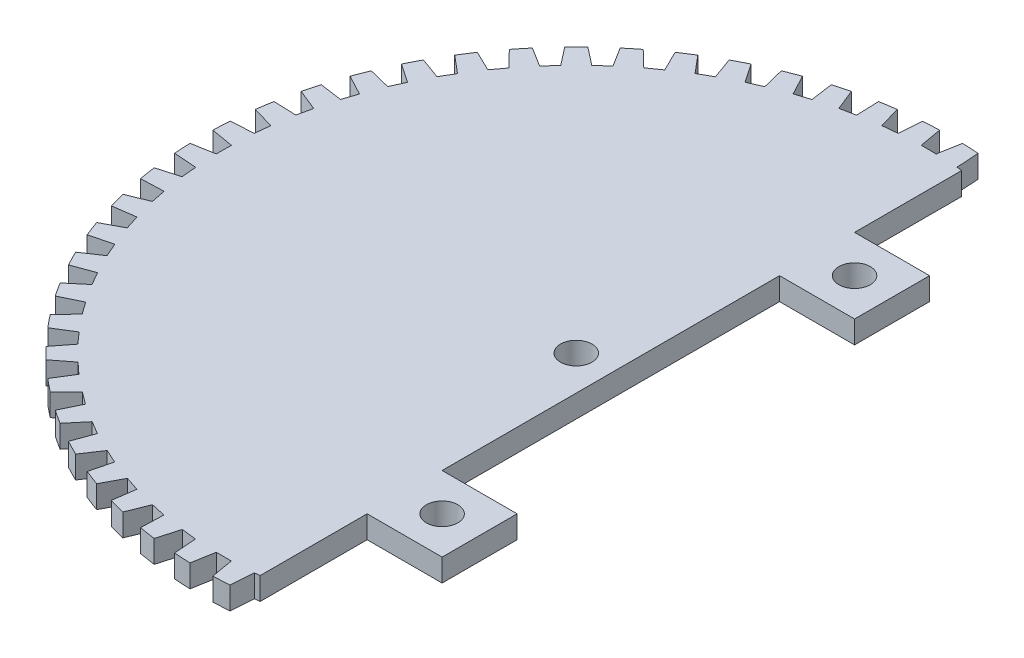
from build123d import *

# Parameters (mm, degrees)
SKETCH_1_R               = 50
EXTRUDE_1_DEPTH          = 3
CUT_EXTRUDE_START        = -3
CUT_EXTRUDE_1_DEPTH      = 3
PATTERN_CIRCULAR_1_COUNT = 60
SKETCH_3_R               = 2.1
CUT_EXTRUDE_2_DEPTH      = 3
SKETCH_7_W               = 107.754666761
SKETCH_7_H               = 25.516796979
CUT_EXTRUDE_3_DEPTH      = 63
SKETCH_8_W               = 20
SKETCH_8_H               = 10
EXTRUDE_2_DEPTH          = 3
SKETCH_9_R               = 2.1
CUT_EXTRUDE_4_DEPTH      = 19


with BuildPart() as part:
    # Эскиз1 → Бобышка-Вытянуть1 (new body)
    with BuildSketch(Plane(origin=(0, 0, 0), x_dir=(1, 0, 0), z_dir=(0, 1, 0))):
        with Locations(Location((0, 0, 0), (0, 0, 270))):
            Circle(SKETCH_1_R)
    extrude(amount=EXTRUDE_1_DEPTH)

    # Эскиз2 → Вырез-Вытянуть1 (cut)
    with BuildSketch(Plane(origin=(0, 3, 0), x_dir=(1, 0, 0), z_dir=(0, 1, 0)).offset(CUT_EXTRUDE_START)):
        with BuildLine():
            Line((-1, 47.010639502), (1, 46.989360498))
            Line((1, 46.989360498), (1.526745916, 49.976685033))
            ThreePointArc((1.526745916, 49.976685033), (0.001866861, 49.999999965), (-1.523013931, 49.976798903))
            Line((-1.523013931, 49.976798903), (-1, 47.010639502))
        make_face()
    cut_extrude_1 = extrude(amount=CUT_EXTRUDE_1_DEPTH, mode=Mode.SUBTRACT)

    # Круговой массив1: Вырез-Вытянуть1 ×60 about axis
    pattern_circular_1_axis = Axis((0, 0, 0), (0, 1, 0))
    for i in range(1, PATTERN_CIRCULAR_1_COUNT):
        add(cut_extrude_1.rotate(pattern_circular_1_axis, i * 360 / PATTERN_CIRCULAR_1_COUNT), mode=Mode.SUBTRACT)

    # Эскиз3 → Вырез-Вытянуть2 (cut)
    with BuildSketch(Plane(origin=(0, 3, 0), x_dir=(1, 0, 0), z_dir=(0, 1, 0))):
        with Locations(Location((0, 0, 0), (0, 0, 270))):
            Circle(SKETCH_3_R)
    extrude(amount=-CUT_EXTRUDE_2_DEPTH, mode=Mode.SUBTRACT)

    # Эскиз7 → Вырез-Вытянуть3 (cut)
    with BuildSketch(Plane(origin=(4.611469334, 0, 0), x_dir=(0, 0, -1), z_dir=(1, 0, 0))):
        with Locations((0.845436045, 1.078554444)):
            Rectangle(SKETCH_7_W, SKETCH_7_H)
    extrude(amount=CUT_EXTRUDE_3_DEPTH, mode=Mode.SUBTRACT)

    # Эскиз8 → Бобышка-Вытянуть2 (add)
    with BuildSketch(Plane(origin=(0, 3, 0), x_dir=(1, 0, 0), z_dir=(0, 1, 0))):
        with Locations((4.611469334, 27.5)):
            Rectangle(SKETCH_8_W, SKETCH_8_H)
        with Locations((4.611469334, -27.5)):
            Rectangle(SKETCH_8_W, SKETCH_8_H)
    extrude(amount=-EXTRUDE_2_DEPTH)

    # Эскиз9 → Вырез-Вытянуть4 (cut)
    with BuildSketch(Plane(origin=(0, 3, 0), x_dir=(1, 0, 0), z_dir=(0, 1, 0))):
        with Locations(Location((9.611469334, 27.5, 0), (0, 0, 270))):
            Circle(SKETCH_9_R)
        with Locations(Location((9.611469334, -27.5, 0), (0, 0, 270))):
            Circle(SKETCH_9_R)
    extrude(amount=-CUT_EXTRUDE_4_DEPTH, mode=Mode.SUBTRACT)


solid = part.part
